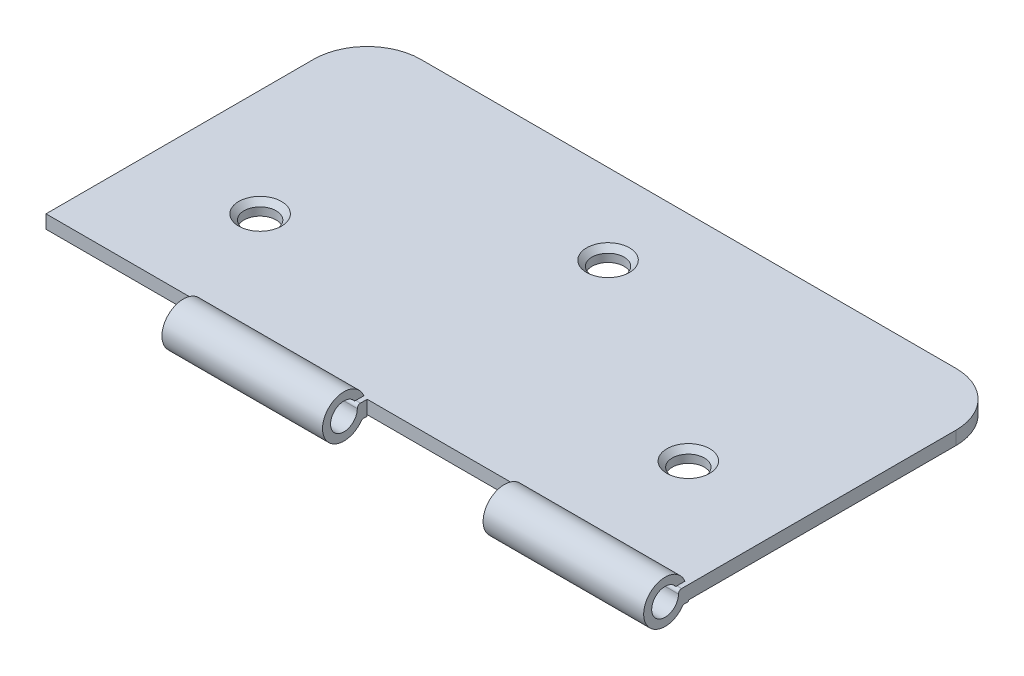
from build123d import *

# Parameters (mm, degrees)
SKETCH1_W           = 120
SKETCH1_H           = 60
BOSS_EXTRUDE1_DEPTH = 2.5
FILLET1_R           = 10
BOSS_EXTRUDE2_DEPTH = 30
LPATTERN1_COUNT     = 2
LPATTERN1_PITCH     = 60
SKETCH3_R           = 3
CUT_EXTRUDE1_DEPTH  = 72.3539808
CHAMFER1_SIZE       = 1


with BuildPart() as part:
    # Sketch1 → Boss-Extrude1 (new body)
    with BuildSketch(Plane(origin=(0, 0, 0), x_dir=(1, 0, 0), z_dir=(0, 1, 0))):
        Rectangle(SKETCH1_W, SKETCH1_H)
    extrude(amount=BOSS_EXTRUDE1_DEPTH)

    # Fillet1
    fillet1_edges = [part.edges().sort_by_distance(p)[0] for p in [
        (-60, 1.25, -30),
        (60, 1.25, -30),
    ]]
    fillet(fillet1_edges, radius=FILLET1_R)

    # Sketch3 → Cut-Extrude1 (cut, through all)
    with BuildSketch(Plane(origin=(0, 2.5, 0), x_dir=(1, 0, 0), z_dir=(0, 1, 0))):
        with Locations(Location((40, -10, 0), (0, 0, 270))):
            Circle(SKETCH3_R)
        with Locations(Location((0, 15, 0), (0, 0, 270))):
            Circle(SKETCH3_R)
        with Locations(Location((-40, -10, 0), (0, 0, 270))):
            Circle(SKETCH3_R)
    extrude(amount=-CUT_EXTRUDE1_DEPTH, mode=Mode.SUBTRACT)

    # Chamfer1
    chamfer1_edges = [part.edges().sort_by_distance(p)[0] for p in [
        (40, 2.5, 7),
        (0, 2.5, -18),
        (-40, 2.5, 7),
    ]]
    chamfer(chamfer1_edges, length=CHAMFER1_SIZE)


with BuildPart() as body_2:
    # Sketch2 → Boss-Extrude2 (new body)
    with BuildSketch(Plane(origin=(60, 0, 0), x_dir=(0, 0, -1), z_dir=(1, 0, 0))):
        with BuildLine():
            Line((-30, 2.5), (-30, -0.25))
            Line((-30, -0.25), (-30.7, -0.25))
            ThreePointArc((-30.7, -0.25), (-30.927169701, -0.304585668), (-31.104738562, -0.456424292))
            ThreePointArc((-31.104738562, -0.456424292), (-38.311548677, 2.389996547), (-30.625, 3.368358986))
            Line((-30.625, 3.368358986), (-32.325, 3.368358986))
            ThreePointArc((-32.325, 3.368358986), (-36.717094098, 1.109876278), (-31.842676994, 1.904415516))
            ThreePointArc((-31.842676994, 1.904415516), (-31.670115132, 2.325380148), (-31.25, 2.5))
            Line((-31.25, 2.5), (-30, 2.5))
        make_face()
    extrude(amount=-BOSS_EXTRUDE2_DEPTH)


with BuildPart() as lpattern1_1:
    # LPattern1: pattern copy
    add(body_2.part.moved(Location(Vector(-1, 0, 0) * (1 * LPATTERN1_PITCH))))

    # Combine1: union body 2, part
    add(body_2.part)
    add(part.part)


solid = lpattern1_1.part
